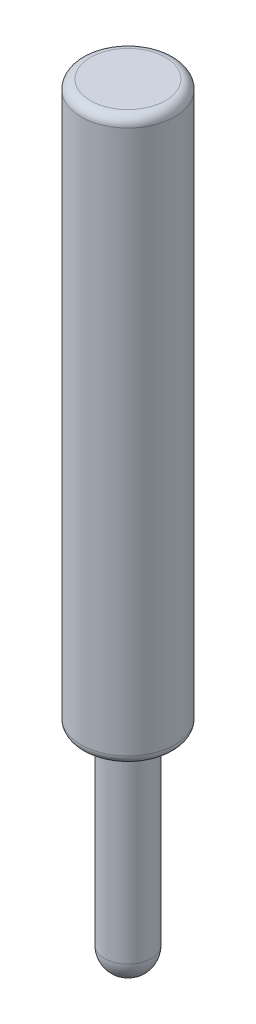
from build123d import *
from build123d.topology import SkipClean

# Parameters (mm, degrees)
SKETCH_1_R      = 5
EXTRUDE_1_DEPTH = 60
SKETCH_2_R      = 2.5
EXTRUDE_2_DEPTH = 20
FILLET_1_R      = 1


with BuildPart() as part:
    # 草图1 → 凸台-拉伸1 (new body)
    with BuildSketch(Plane(origin=(0, 0, 0), x_dir=(1, 0, 0), z_dir=(0, 1, 0))):
        with Locations(Location((0, 0, 0), (0, 0, 270))):
            Circle(SKETCH_1_R)
    extrude(amount=EXTRUDE_1_DEPTH)

    # 草图2 → 凸台-拉伸2 (add)
    with BuildSketch(Plane(origin=(0, 0, 0), x_dir=(1, 0, 0), z_dir=(0, 1, 0))):
        with Locations(Location((0, 0, 0), (0, 0, 270))):
            Circle(SKETCH_2_R)
    extrude(amount=-EXTRUDE_2_DEPTH)

    # 草图3 → 旋转1 (revolve)
    with SkipClean():  # the faces are left unmerged after this step: merging them gives an invalid solid
        with BuildSketch(Plane.XY):
            with BuildLine():
                ThreePointArc((2.5, -20), (1.767766953, -18.232233047), (0, -17.5))
                Line((0, -17.5), (0, -22.5))
                ThreePointArc((0, -22.5), (1.767766953, -21.767766953), (2.5, -20))
            make_face()
            with BuildLine():
                Line((0, -22.5), (0, -17.5))
                ThreePointArc((0, -17.5), (-2.5, -20), (0, -22.5))
            make_face()
        revolve(axis=Axis((0, -17.5, 0), (0, -1, 0)))

    # 圆角1
    fillet_1_edges = [part.edges().sort_by_distance(p)[0] for p in [
        (0, 0, -5),
        (0, 60, -5),
    ]]
    fillet(fillet_1_edges, radius=FILLET_1_R)


solid = part.part
